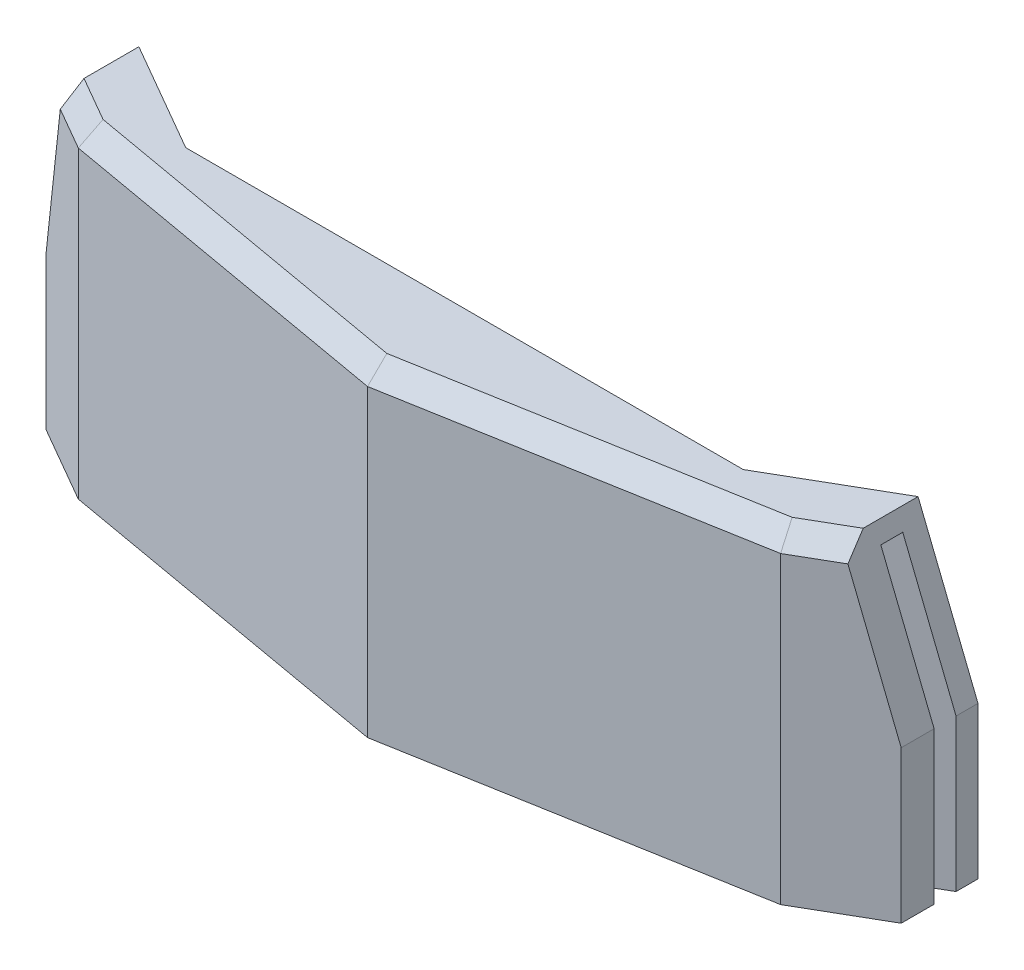
from build123d import *

# Parameters (mm, degrees)
BOSS_EXTRUDE2_DEPTH = 34
CUT_EXTRUDE2_DEPTH  = 32
BOSS_EXTRUDE3_DEPTH = 2
CHAMFER1_SIZE       = 2
CUT_EXTRUDE3_START  = -16.19797
CUT_EXTRUDE3_DEPTH  = 10.135705


with BuildPart() as part:
    # Sketch4 → Boss-Extrude2 (new body)
    with BuildSketch(Plane(origin=(0, 0, 0), x_dir=(1, 0, 0), z_dir=(0, 1, 0))):
        Polygon((-45, 16.197969794), (-45, 8.115066025), (-36.954004115, 3.469708135), (0, -3.046279836), (36.954004115, 3.469708135), (45, 8.115066025), (45, 16.197969794), (38, 12.156517909), (38, 7.537715756), (35.912115049, 6.332274817), (0, 0), (-35.912115049, 6.332274817), (-38, 7.537715756), (-38, 12.156517909), align=None)
    extrude(amount=BOSS_EXTRUDE2_DEPTH)

    # Sketch5 → Cut-Extrude2 (cut)
    with BuildSketch(Plane.XZ):
        Polygon((-40, -8.692416294), (-45, -11.57916764), (-45, -13.888568717), (-40, -11.001817371), align=None)
        Polygon((40, -8.692416294), (45, -11.57916764), (45, -13.888568717), (40, -11.001817371), align=None)
    extrude(amount=-CUT_EXTRUDE2_DEPTH, mode=Mode.SUBTRACT)

    # Sketch6 → Boss-Extrude3 (add)
    with BuildSketch(Plane(origin=(0, 34, 0), x_dir=(1, 0, 0), z_dir=(0, 1, 0))):
        Polygon((38, 12.156517909), (38, 7.537715756), (35.912115049, 6.332274817), (0, 0), (-35.912115049, 6.332274817), (-38, 7.537715756), (-38, 12.156517909), (-29.339745962, 7.156517909), (29.339745962, 7.156517909), align=None)
    extrude(amount=-BOSS_EXTRUDE3_DEPTH)

    # Chamfer1
    chamfer1_edges = [part.edges().sort_by_distance(p)[0] for p in [
        (-40.977002058, 34, -5.79238708),
        (-18.477002058, 34, -0.21171415),
        (18.477002058, 34, -0.21171415),
        (40.977002058, 34, -5.79238708),
    ]]
    chamfer(chamfer1_edges, length=CHAMFER1_SIZE)

    # Sketch7 → Cut-Extrude3 (cut)
    with BuildSketch(Plane.XY.offset(CUT_EXTRUDE3_START)):
        Polygon((-45, 16), (-45, 34), (-41, 34), align=None)
        Polygon((45, 16), (41, 34), (45, 34), align=None)
    extrude(amount=CUT_EXTRUDE3_DEPTH, mode=Mode.SUBTRACT)


solid = part.part
